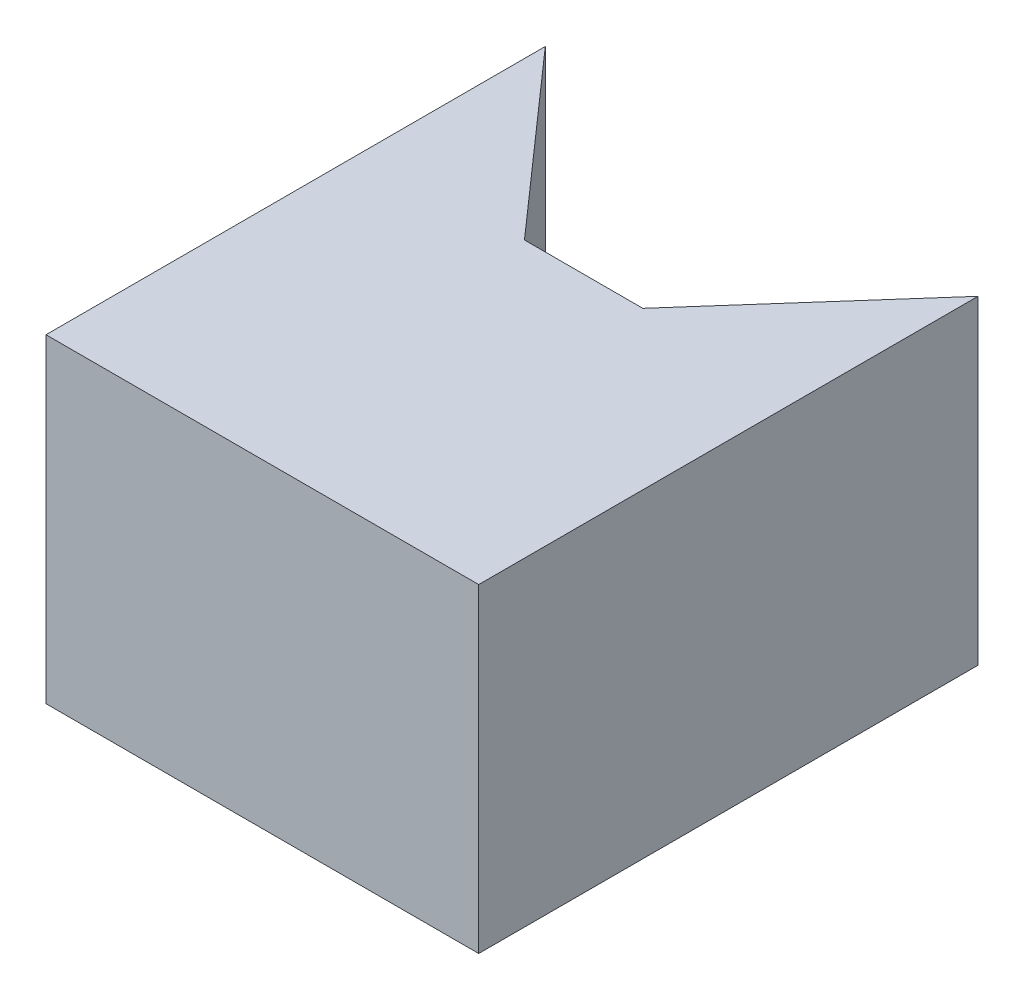
from build123d import *

# Parameters (mm, degrees)
BOSS_EXTRUDE1_DEPTH = 48


with BuildPart() as part:
    # Sketch1 → Boss-Extrude1 (new body)
    with BuildSketch(Plane(origin=(0, 0, 0), x_dir=(1, 0, 0), z_dir=(0, 1, 0))):
        Polygon((8.89, 0), (-8.89, 0), (-32.5, 26.74), (-32.5, -48.26), (32.5, -48.26), (32.5, 26.74), align=None)
    extrude(amount=BOSS_EXTRUDE1_DEPTH)


solid = part.part
